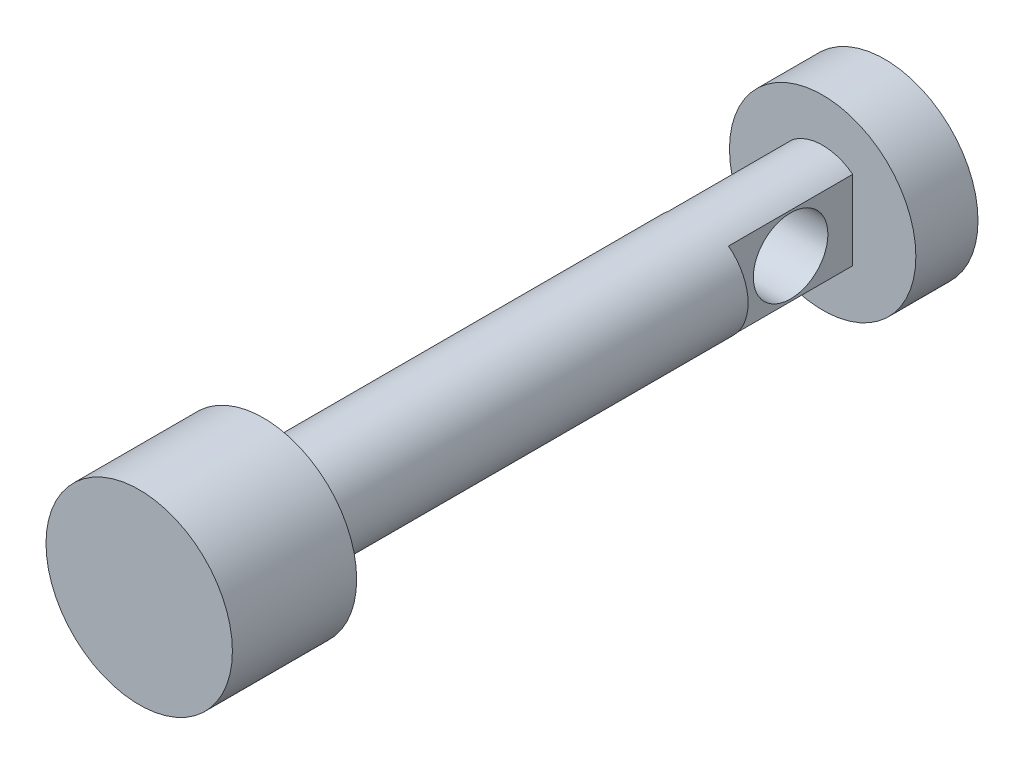
from build123d import *

# Parameters (mm, degrees)
CORTE_EXTRUS_O1_DEPTH      = 64.639610307
CORTE_EXTRUS_O1_DEPTH_BACK = 64.639610307
ESBO_O2_R                  = 6
CORTE_EXTRUS_O2_START      = -30
CORTE_EXTRUS_O2_DEPTH      = 30
BOSS_EXTRUDE1_START        = -10
SKETCH1_R                  = 15
BOSS_EXTRUDE1_DEPTH        = 10


with BuildPart() as part:
    # Esboço1 → Revolução1 (revolve)
    with BuildSketch(Plane(origin=(0, 0, 0), x_dir=(0, 0, -1), z_dir=(1, 0, 0)), mode=Mode.PRIVATE) as revolu_o1_sk:
        Polygon((-60, 0), (60, 0), (60, 8), (-40, 8), (-40, 15), (-60, 15), align=None)
    revolve(revolu_o1_sk.sketch.rotate(Axis((0, 0, 60), (0, 0, -1)), 90), axis=Axis((0, 0, 60), (0, 0, -1)))

    # Esboço2 → Corte-extrusão1 (cut, two sides: drawn at the far end of the back side and taken through both)
    with BuildSketch(Plane(origin=(0, 0, 0), x_dir=(0, 0, -1), z_dir=(1, 0, 0)).offset(-CORTE_EXTRUS_O1_DEPTH_BACK)):
        with Locations((40, 0)):
            Circle(ESBO_O2_R)
    extrude(amount=CORTE_EXTRUS_O1_DEPTH + CORTE_EXTRUS_O1_DEPTH_BACK, mode=Mode.SUBTRACT)

    # Esboço3 → Corte-extrusão2 (cut)
    with BuildSketch(Plane(origin=(0, 0, -60), x_dir=(-1, 0, 0), z_dir=(0, 0, -1)).offset(CORTE_EXTRUS_O2_START)):
        with BuildLine():
            Line((-4.839112888, -6.370477726), (-4.839112888, 6.370477726))
            ThreePointArc((-4.839112888, 6.370477726), (-8, 0), (-4.839112888, -6.370477726))
        make_face()
        with BuildLine():
            ThreePointArc((8, 0), (7.166341574, 3.555776771), (4.839112888, 6.370477726))
            Line((4.839112888, 6.370477726), (4.839112888, -6.370477726))
            ThreePointArc((4.839112888, -6.370477726), (7.166341574, -3.555776771), (8, 0))
        make_face()
    extrude(amount=CORTE_EXTRUS_O2_DEPTH, mode=Mode.SUBTRACT)

    # Sketch1 → Boss-Extrude1 (add)
    with BuildSketch(Plane(origin=(0, 0, -60), x_dir=(-1, 0, 0), z_dir=(0, 0, -1)).offset(BOSS_EXTRUDE1_START)):
        with Locations(Location((0, 0, 0), (0, 0, 180))):
            Circle(SKETCH1_R)
    extrude(amount=BOSS_EXTRUDE1_DEPTH)


solid = part.part
